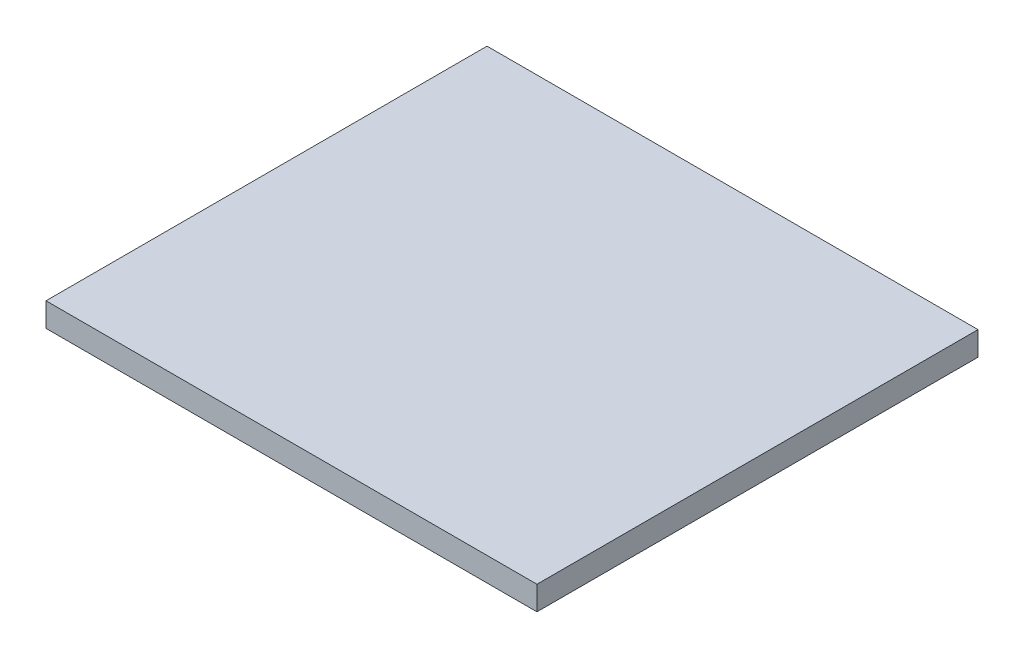
from build123d import *

# Parameters (mm, degrees)
SKETCH1_W           = 374.65
SKETCH1_H           = 336.55
BOSS_EXTRUDE1_DEPTH = 18.25625


with BuildPart() as part:
    # Sketch1 → Boss-Extrude1 (new body)
    with BuildSketch(Plane(origin=(0, 0, 0), x_dir=(1, 0, 0), z_dir=(0, 1, 0))):
        with Locations((0, 168.275)):
            Rectangle(SKETCH1_W, SKETCH1_H)
    extrude(amount=BOSS_EXTRUDE1_DEPTH)


solid = part.part
